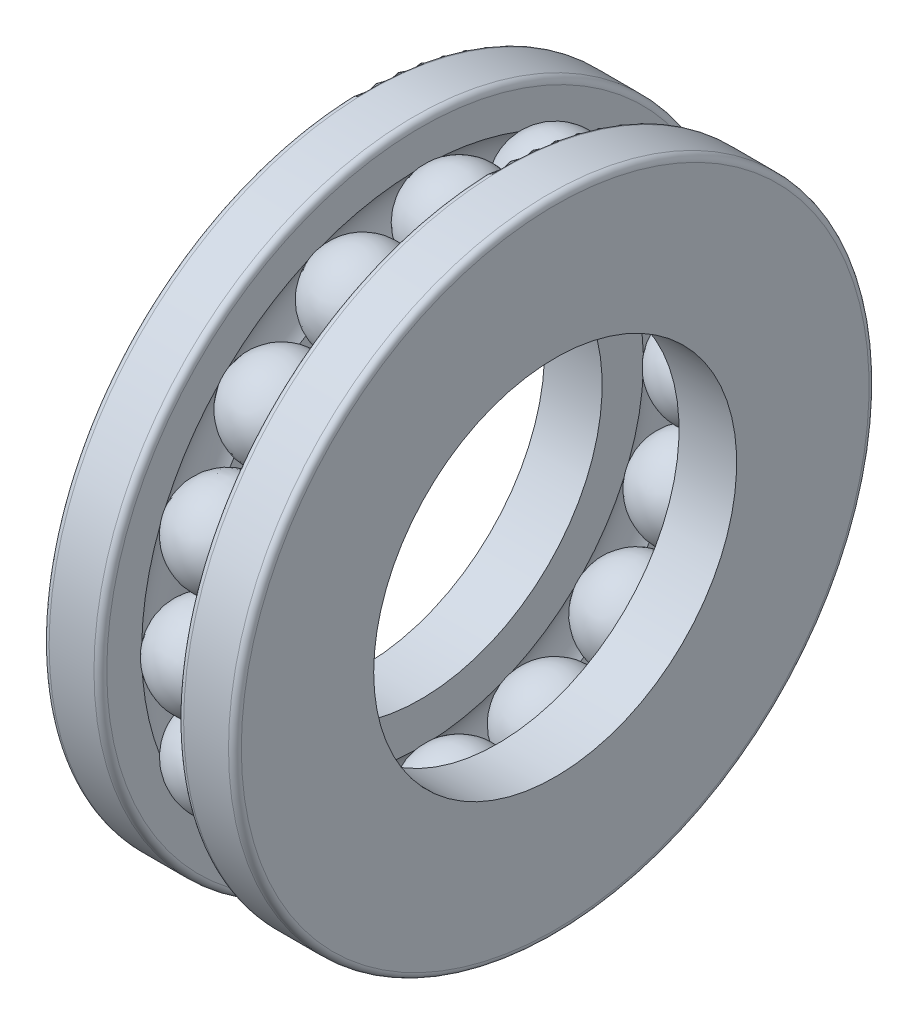
from build123d import *

# Parameters (mm, degrees)
CIRCULAR_PATTERN1_COUNT = 16
FILLET1_R               = 0.3


with BuildPart() as part:
    # Sketch1 → Revolve1 (revolve)
    with BuildSketch(Plane(origin=(0, 0, 0), x_dir=(0, 1, 0), z_dir=(0, 0, 1))):
        with BuildLine():
            Line((9.5, 0), (14, 0))
            ThreePointArc((14, 0), (11.75, -2.25), (9.5, 0))
        make_face()
    revolve1 = revolve(axis=Axis((0, 4.377607515, 0), (0, 1, 0)))

    # Sketch2 → Revolve2 (revolve)
    with BuildSketch(Plane(origin=(0, 0, 0), x_dir=(0, 1, 0), z_dir=(0, 0, 1)), mode=Mode.PRIVATE) as revolve2_sk:
        with BuildLine():
            Line((8.5, 4.5), (8.5, 1.8))
            Line((8.5, 1.8), (10.433603403, 1.8))
            ThreePointArc((10.433603403, 1.8), (11.75, 2.23), (13.066396597, 1.8))
            Line((13.066396597, 1.8), (15, 1.8))
            Line((15, 1.8), (15, 4.5))
            Line((15, 4.5), (8.5, 4.5))
        make_face()
    revolve(revolve2_sk.sketch.rotate(Axis((-4.873642073, 0, 0), (1, 0, 0)), 90), axis=Axis((-4.873642073, 0, 0), (1, 0, 0)))

    # Sketch3 → Revolve3 (revolve)
    with BuildSketch(Plane(origin=(0, 0, 0), x_dir=(0, 1, 0), z_dir=(0, 0, 1)), mode=Mode.PRIVATE) as revolve3_sk:
        with BuildLine():
            Line((8.5, -1.8), (10.433603403, -1.8))
            ThreePointArc((10.433603403, -1.8), (11.75, -2.23), (13.066396597, -1.8))
            Line((13.066396597, -1.8), (15, -1.8))
            Line((15, -1.8), (15, -4.5))
            Line((15, -4.5), (8.5, -4.5))
            Line((8.5, -4.5), (8.5, -1.8))
        make_face()
    revolve(revolve3_sk.sketch.rotate(Axis((-8.725907029, 0, 0), (1, 0, 0)), 90), axis=Axis((-8.725907029, 0, 0), (1, 0, 0)))

    # Circular-Pattern1: Revolve1 ×16 about axis
    circular_pattern1_axis = Axis((0, 0, 0), (1, 0, 0))
    for i in range(1, CIRCULAR_PATTERN1_COUNT):
        add(revolve1.rotate(circular_pattern1_axis, i * 360 / CIRCULAR_PATTERN1_COUNT))

    # Fillet1
    fillet1_edges = [part.edges().sort_by_distance(p)[0] for p in [
        (4.5, 0, -15),
        (1.8, 0, -15),
        (-4.5, 0, -15),
        (-1.8, 0, -15),
    ]]
    fillet(fillet1_edges, radius=FILLET1_R)


solid = part.part
